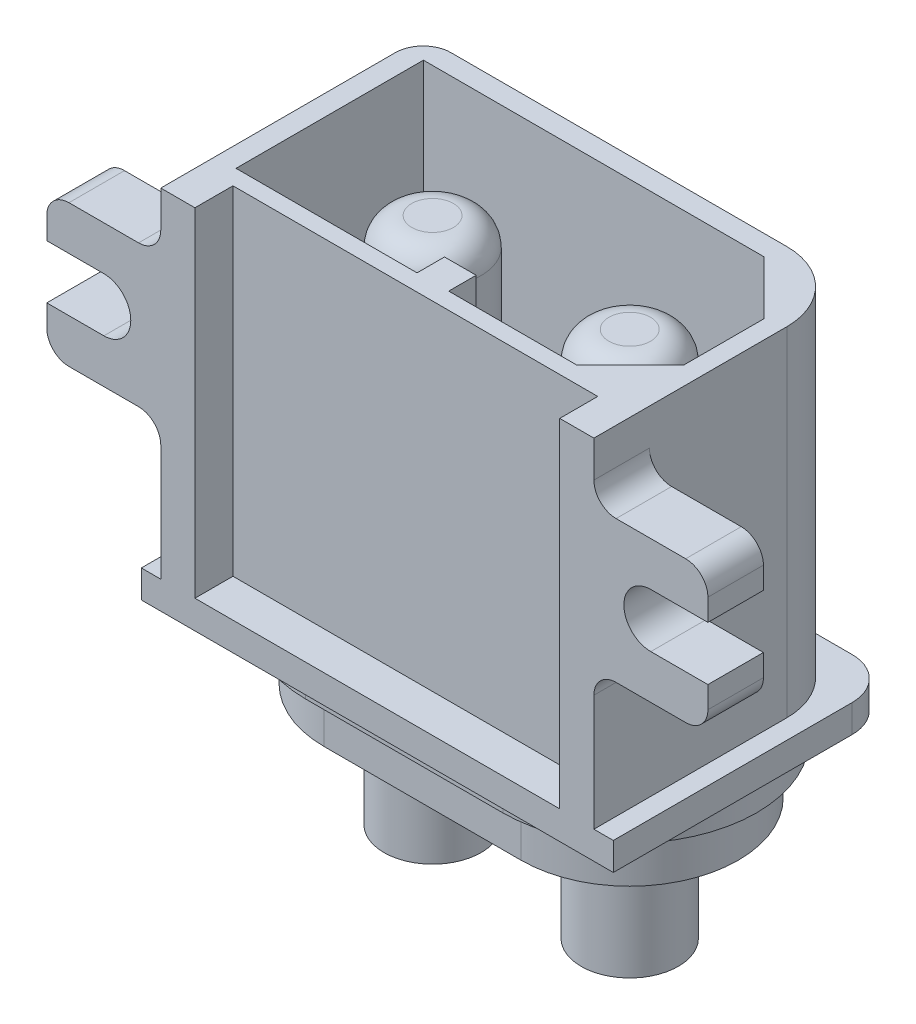
from build123d import *

# Parameters (mm, degrees)
BOSS_EXTRUDE1_DEPTH        = 13.2
CUT_EXTRUDE1_DEPTH         = 8.6
BOSS_EXTRUDE2_DEPTH        = 7.1
BOSS_EXTRUDE2_DEPTH_BACK   = 11.9
SKETCH3_R                  = 1.75
BOSS_EXTRUDE2_2_DEPTH      = 7.1
BOSS_EXTRUDE2_2_DEPTH_BACK = 11.9
SKETCH4_W                  = 13.14
SKETCH4_H                  = 1.37
CUT_EXTRUDE2_DEPTH         = 12.18
BOSS_EXTRUDE3_DEPTH        = 1
BOSS_EXTRUDE4_DEPTH        = 1.1
SKETCH7_R                  = 2.5
BOSS_EXTRUDE5_DEPTH        = 1.81
SKETCH8_R                  = 1.15
CUT_EXTRUDE3_DEPTH         = 7
BOSS_EXTRUDE6_DEPTH        = 2
FILLET1_R                  = 1


with BuildPart() as part:
    # Sketch1 → Boss-Extrude1 (new body)
    with BuildSketch(Plane(origin=(0, 0, 0), x_dir=(1, 0, 0), z_dir=(0, 1, 0))):
        with BuildLine():
            Line((8.864150943, 1.753207547), (8.864150943, -5.196792453))
            Line((8.864150943, -5.196792453), (-6.735849057, -5.196792453))
            Line((-6.735849057, -5.196792453), (-6.735849057, 3.253207547))
            ThreePointArc((-6.735849057, 3.253207547), (-6.442955838, 3.960314328), (-5.735849057, 4.253207547))
            Line((-5.735849057, 4.253207547), (6.364150943, 4.253207547))
            ThreePointArc((6.364150943, 4.253207547), (8.131917896, 3.5209745), (8.864150943, 1.753207547))
        make_face()
    extrude(amount=BOSS_EXTRUDE1_DEPTH)

    # Sketch2 → Cut-Extrude1 (cut)
    with BuildSketch(Plane(origin=(0, 13.2, 0), x_dir=(1, 0, 0), z_dir=(0, 1, 0))):
        Polygon((-5.995849057, 3.523207547), (-5.995849057, -3.226792453), (0.524150943, -3.226792453), (0.524150943, -2.236792453), (1.664150943, -2.236792453), (1.664150943, -3.226792453), (6.279150943, -3.226792453), (8.204150943, -1.301792453), (8.204150943, 1.598207547), (6.279150943, 3.523207547), align=None)
    extrude(amount=-CUT_EXTRUDE1_DEPTH, mode=Mode.SUBTRACT)

    # Sketch4 → Cut-Extrude2 (cut)
    with BuildSketch(Plane(origin=(0, 13.2, 0), x_dir=(1, 0, 0), z_dir=(0, 1, 0))):
        with Locations((1.064150943, -4.511792453)):
            Rectangle(SKETCH4_W, SKETCH4_H)
    extrude(amount=-CUT_EXTRUDE2_DEPTH, mode=Mode.SUBTRACT)



with BuildPart() as body_2:
    # Sketch3 → Boss-Extrude2 (new, two sides: drawn at the far end of the back side and taken through both)
    with BuildSketch(Plane(origin=(0, 4.6, 0), x_dir=(1, 0, 0), z_dir=(0, 1, 0)).offset(-BOSS_EXTRUDE2_DEPTH_BACK)):
        with Locations(Location((-2.485849057, 0.343207547, 0), (0, 0, 270))):
            Circle(SKETCH3_R)
    extrude(amount=BOSS_EXTRUDE2_DEPTH + BOSS_EXTRUDE2_DEPTH_BACK)


with BuildPart() as body_3:
    # Sketch3 → Boss-Extrude2 2 (new, two sides: drawn at the far end of the back side and taken through both)
    with BuildSketch(Plane(origin=(0, 4.6, 0), x_dir=(1, 0, 0), z_dir=(0, 1, 0)).offset(-BOSS_EXTRUDE2_2_DEPTH_BACK)):
        with Locations(Location((4.614150943, 0.343207547, 0), (0, 0, 270))):
            Circle(SKETCH3_R)
    extrude(amount=BOSS_EXTRUDE2_2_DEPTH + BOSS_EXTRUDE2_2_DEPTH_BACK)


with BuildPart() as part_1:
    add(part.part)

    add(body_2.part)  # Boss-Extrude3 merges body 2

    add(body_3.part)  # Boss-Extrude3 merges body 3
    # Sketch5 → Boss-Extrude3 (add)
    with BuildSketch(Plane.XZ):
        with BuildLine():
            Line((-7.435849057, 5.196792453), (9.564150943, 5.196792453))
            Line((9.564150943, 5.196792453), (9.564150943, -3.403207547))
            ThreePointArc((9.564150943, -3.403207547), (9.124811115, -4.463867719), (8.064150943, -4.903207547))
            Line((8.064150943, -4.903207547), (-5.935849057, -4.903207547))
            ThreePointArc((-5.935849057, -4.903207547), (-6.996509228, -4.463867719), (-7.435849057, -3.403207547))
            Line((-7.435849057, -3.403207547), (-7.435849057, 5.196792453))
        make_face()
    extrude(amount=-BOSS_EXTRUDE3_DEPTH)

    # Sketch6 → Boss-Extrude4 (add)
    with BuildSketch(Plane.XZ):
        with BuildLine():
            Line((-2.485849057, 4.226792453), (4.614150943, 4.226792453))
            ThreePointArc((4.614150943, 4.226792453), (9.184150943, -0.343207547), (4.614150943, -4.913207547))
            Line((4.614150943, -4.913207547), (-2.485849057, -4.913207547))
            ThreePointArc((-2.485849057, -4.913207547), (-7.055849057, -0.343207547), (-2.485849057, 4.226792453))
        make_face()
    extrude(amount=BOSS_EXTRUDE4_DEPTH)

    # Sketch7 → Boss-Extrude5 (add)
    with BuildSketch(Plane(origin=(0, -1.1, 0), x_dir=(-1, 0, 0), z_dir=(0, -1, 0))):
        with BuildLine():
            Line((2.485849057, -3.566792453), (-4.614150943, -3.566792453))
            ThreePointArc((-4.614150943, -3.566792453), (-8.524150943, 0.343207547), (-4.614150943, 4.253207547))
            Line((-4.614150943, 4.253207547), (2.485849057, 4.253207547))
            ThreePointArc((2.485849057, 4.253207547), (6.395849057, 0.343207547), (2.485849057, -3.566792453))
        make_face()
        with Locations(Location((2.485849057, 0.343207547, 0), (0, 0, 270))):
            Circle(SKETCH7_R, mode=Mode.SUBTRACT)
        with Locations(Location((-4.614150943, 0.343207547, 0), (0, 0, 270))):
            Circle(SKETCH7_R, mode=Mode.SUBTRACT)
    extrude(amount=BOSS_EXTRUDE5_DEPTH)

    # Sketch8 → Cut-Extrude3 (cut)
    with BuildSketch(Plane.XZ.offset(7.3)):
        with Locations(Location((4.614150943, -0.343207547, 0), (0, 0, 270))):
            Circle(SKETCH8_R)
        with Locations(Location((-2.485849057, -0.343207547, 0), (0, 0, 270))):
            Circle(SKETCH8_R)
    extrude(amount=-CUT_EXTRUDE3_DEPTH, mode=Mode.SUBTRACT)

    # Sketch9 → Boss-Extrude6 (add)
    with BuildSketch(Plane.XY.offset(5.196792453)):
        with BuildLine():
            Line((-7.535849057, 11.09), (-10.042204833, 11.09))
            ThreePointArc((-10.042204833, 11.09), (-10.607890258, 10.855685425), (-10.842204833, 10.29))
            Line((-10.842204833, 10.29), (-10.842204833, 9.50439657))
            Line((-10.842204833, 9.50439657), (-8.785849057, 9.50439657))
            ThreePointArc((-8.785849057, 9.50439657), (-7.816452486, 8.535), (-8.785849057, 7.56560343))
            Line((-8.785849057, 7.56560343), (-10.842204833, 7.56560343))
            Line((-10.842204833, 7.56560343), (-10.842204833, 6.78))
            ThreePointArc((-10.842204833, 6.78), (-10.607890258, 6.214314575), (-10.042204833, 5.98))
            Line((-10.042204833, 5.98), (-7.535849057, 5.98))
            ThreePointArc((-7.535849057, 5.98), (-6.970163632, 5.745685425), (-6.735849057, 5.18))
            Line((-6.735849057, 5.18), (-6.735849057, 11.89))
            ThreePointArc((-6.735849057, 11.89), (-6.970163632, 11.324314575), (-7.535849057, 11.09))
        make_face()
        with BuildLine():
            Line((12.97050672, 7.56560343), (12.97050672, 6.78))
            ThreePointArc((12.97050672, 6.78), (12.736192145, 6.214314575), (12.17050672, 5.98))
            Line((12.17050672, 5.98), (9.664150943, 5.98))
            ThreePointArc((9.664150943, 5.98), (9.098465518, 5.745685425), (8.864150943, 5.18))
            Line((8.864150943, 5.18), (8.864150943, 11.89))
            ThreePointArc((8.864150943, 11.89), (9.098465518, 11.324314575), (9.664150943, 11.09))
            Line((9.664150943, 11.09), (12.17050672, 11.09))
            ThreePointArc((12.17050672, 11.09), (12.736192145, 10.855685425), (12.97050672, 10.29))
            Line((12.97050672, 10.29), (12.97050672, 9.50439657))
            Line((12.97050672, 9.50439657), (10.914150943, 9.50439657))
            ThreePointArc((10.914150943, 9.50439657), (9.944754373, 8.535), (10.914150943, 7.56560343))
            Line((10.914150943, 7.56560343), (12.97050672, 7.56560343))
        make_face()
    extrude(amount=-BOSS_EXTRUDE6_DEPTH)

    # Fillet1
    fillet1_edges = [part_1.edges().sort_by_distance(p)[0] for p in [
        (-2.485849057, 11.7, -2.093207547),
        (4.614150943, 11.7, -2.093207547),
    ]]
    fillet(fillet1_edges, radius=FILLET1_R)


solid = part_1.part
